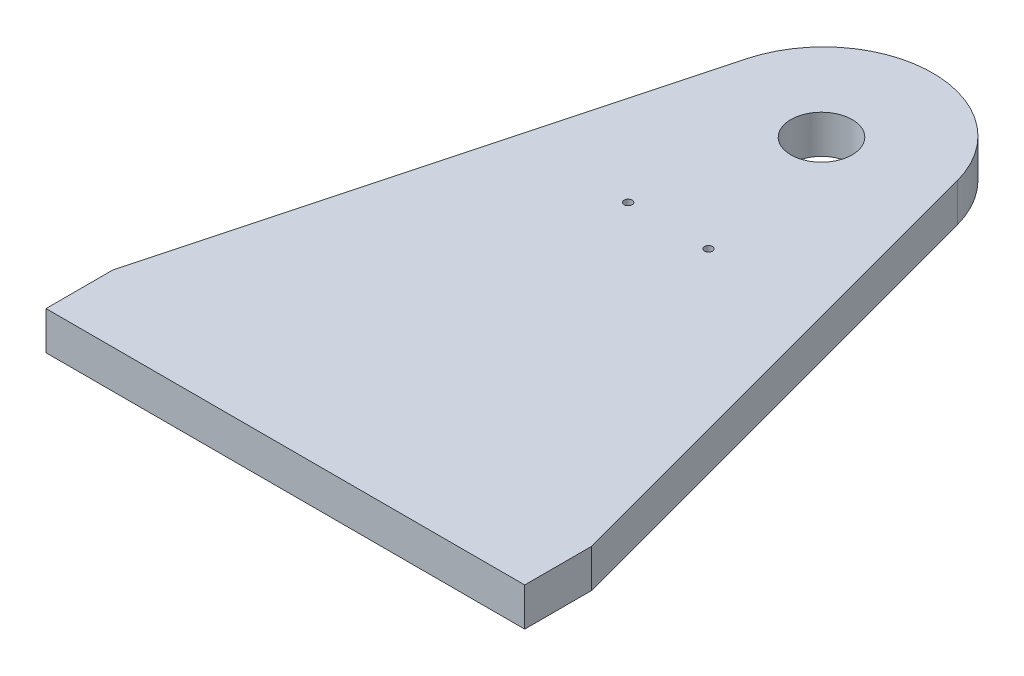
from build123d import *

# Parameters (mm, degrees)
BOSS_EXTRUDE1_DEPTH = 20
SKETCH3_R           = 2.1
SKETCH3_R_2         = 16
CUT_EXTRUDE2_DEPTH  = 20


with BuildPart() as part:
    # Sketch1 → Boss-Extrude1 (new body)
    with BuildSketch(Plane(origin=(0, 0, 0), x_dir=(1, 0, 0), z_dir=(0, 1, 0))):
        with BuildLine():
            Line((-55.118857822, 295.799973098), (-125, 35))
            Line((-125, 35), (-125, 0))
            Line((-125, 0), (125, 0))
            Line((125, 0), (125, 35))
            Line((125, 35), (55.118857822, 295.799973098))
            ThreePointArc((55.118857822, 295.799973098), (0, 338.094160252), (-55.118857822, 295.799973098))
        make_face()
    extrude(amount=BOSS_EXTRUDE1_DEPTH)

    # Sketch3 → Cut-Extrude2 (cut)
    with BuildSketch(Plane(origin=(0, 20, 0), x_dir=(1, 0, 0), z_dir=(0, 1, 0))):
        with Locations(Location((-21, 200, 0), (0, 0, 270))):
            Circle(SKETCH3_R)
        with Locations(Location((21, 200, 0), (0, 0, 90))):
            Circle(SKETCH3_R)
        with Locations(Location((0, 280, 0), (0, 0, 270))):
            Circle(SKETCH3_R_2)
    extrude(amount=-CUT_EXTRUDE2_DEPTH, mode=Mode.SUBTRACT)


solid = part.part
